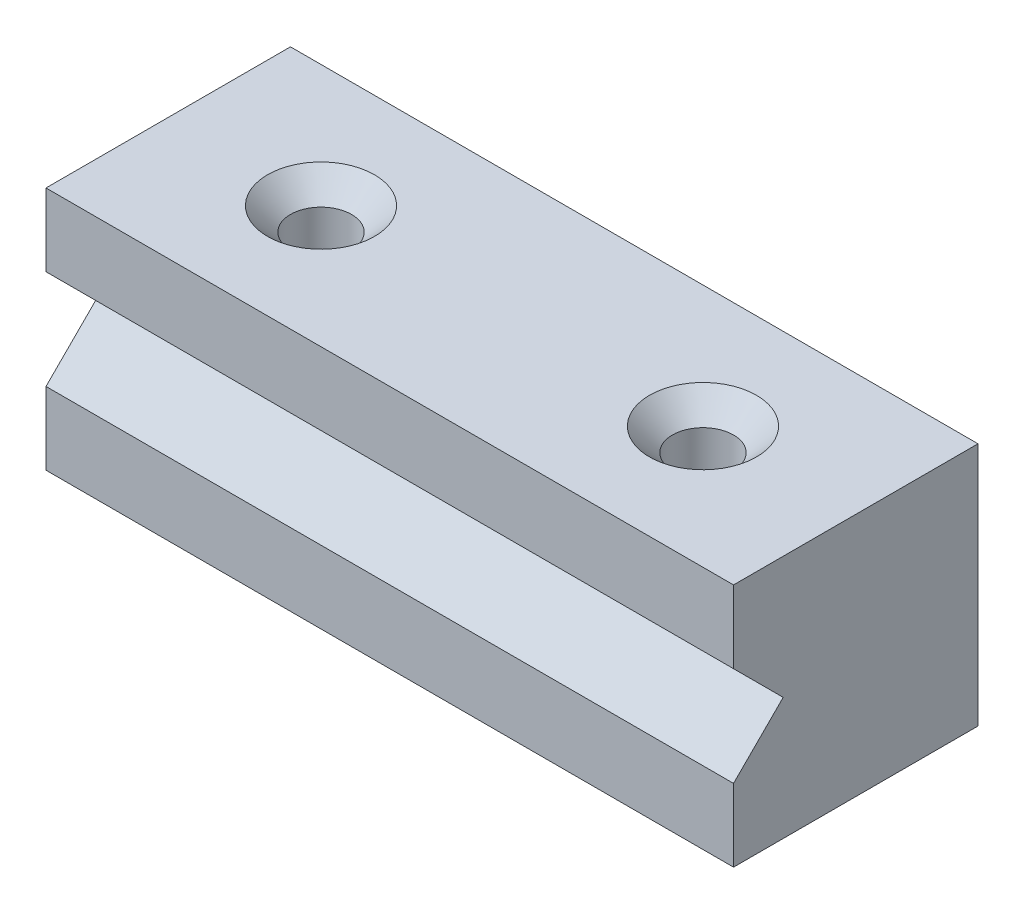
from build123d import *

# Parameters (mm, degrees)
SKETCH1_W             = 90
SKETCH1_H             = 32
BOSS_EXTRUDE1_DEPTH   = 16
CUT_EXTRUDE1_DEPTH    = 93.800862065
F_8_0MM_DOWEL_HOLE1_D = 8
CHAMFER1_SIZE         = 3


with BuildPart() as part:
    # Sketch1 → Boss-Extrude1 (new, symmetric)
    with BuildSketch(Plane.XY):
        Rectangle(SKETCH1_W, SKETCH1_H)
    extrude(amount=BOSS_EXTRUDE1_DEPTH, both=True)

    # Sketch2 → Cut-Extrude1 (cut, through all)
    with BuildSketch(Plane(origin=(45, 0, 0), x_dir=(0, 0, -1), z_dir=(1, 0, 0))):
        Polygon((-16, 6.5), (-9.5, 0), (-16, -6.5), align=None)
    extrude(amount=-CUT_EXTRUDE1_DEPTH, mode=Mode.SUBTRACT)

    # Ø8.0mm Dowel Hole1 (through all)
    with Locations(Plane(origin=(0, 16, 0), x_dir=(1, 0, 0), z_dir=(0, 1, 0))):
        with Locations((-25, 0), (25, 0)):
            Hole(F_8_0MM_DOWEL_HOLE1_D / 2)

    # Chamfer1
    chamfer1_edges = [part.edges().sort_by_distance(p)[0] for p in [
        (29, 16, 0),
        (-21, 16, 0),
    ]]
    chamfer(chamfer1_edges, length=CHAMFER1_SIZE)


solid = part.part
